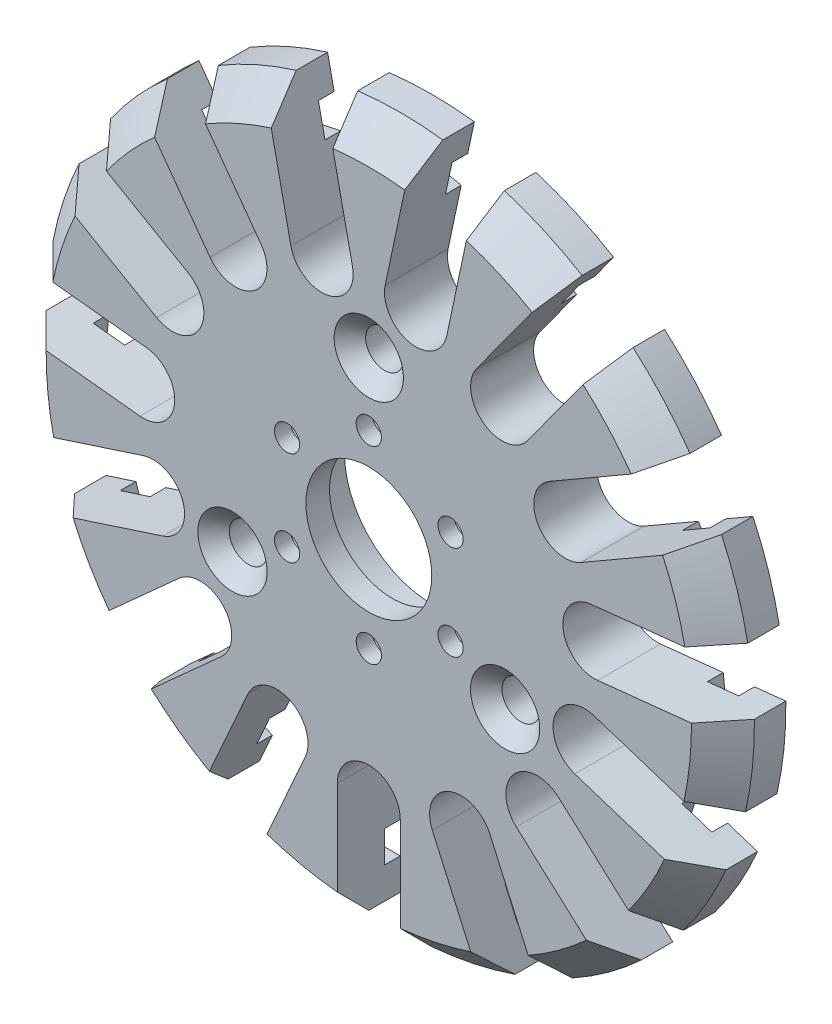
from build123d import *

# Parameters (mm, degrees)
ESBO_O1_R                                            = 22.5
RESSALTO_EXTRUS_O1_DEPTH                             = 4
CHANFRO1_SIZE                                        = 2
ESBO_O4_R                                            = 5.55
CORTE_EXTRUS_O2_DEPTH                                = 2.5
ESBO_O5_R                                            = 4
CORTE_EXTRUS_O3_DEPTH                                = 2
CORTE_EXTRUS_O4_DEPTH                                = 4
PADR_OCIRCULAR1_COUNT                                = 15
ESCAREADO_PARA_PARAFUSO_COM_CABE_A_ESCAR_D           = 2.4
ESCAREADO_PARA_PARAFUSO_COM_CABE_A_ESCAR_CSINK_D     = 4.4
ESCAREADO_PARA_PARAFUSO_COM_CABE_A_ESCAR_CSINK_ANGLE = 90
PADR_OCIRCULAR2_COUNT                                = 6
ESBO_O12_W                                           = 7
ESBO_O12_H                                           = 2
CORTE_EXTRUS_O5_DEPTH                                = 1
PADR_OCIRCULAR3_COUNT                                = 15
PADR_OCIRCULAR4_COUNT                                = 3


with BuildPart() as part:
    # Esboço1 → Ressalto-extrusão1 (new body)
    with BuildSketch(Plane.XY):
        Circle(ESBO_O1_R)
    extrude(amount=RESSALTO_EXTRUS_O1_DEPTH)

    # Chanfro1
    chanfro1_edges = [part.edges().sort_by_distance(p)[0] for p in [
        (-22.5, 0, 4),
    ]]
    chamfer(chanfro1_edges, length=CHANFRO1_SIZE)

    # Esboço4 → Corte-extrusão2 (cut)
    with BuildSketch(Plane(origin=(0, 0, 0), x_dir=(-1, 0, 0), z_dir=(0, 0, -1))):
        Circle(ESBO_O4_R)
    extrude(amount=-CORTE_EXTRUS_O2_DEPTH, mode=Mode.SUBTRACT)

    # Esboço5 → Corte-extrusão3 (cut)
    with BuildSketch(Plane(origin=(0, 0, 2.5), x_dir=(-1, 0, 0), z_dir=(0, 0, -1))):
        Circle(ESBO_O5_R)
    extrude(amount=-CORTE_EXTRUS_O3_DEPTH, mode=Mode.SUBTRACT)

    # Esboço6 → Corte-extrusão4 (cut)
    with BuildSketch(Plane(origin=(0, 0, 0), x_dir=(-1, 0, 0), z_dir=(0, 0, -1))):
        with BuildLine():
            Line((2, -22.410934831), (2, -14.410934831))
            ThreePointArc((2, -14.410934831), (0, -12.410934831), (-2, -14.410934831))
            Line((-2, -14.410934831), (-2, -22.410934831))
            ThreePointArc((-2, -22.410934831), (0, -22.5), (2, -22.410934831))
        make_face()
    corte_extrus_o4 = extrude(amount=-CORTE_EXTRUS_O4_DEPTH, mode=Mode.SUBTRACT)

    # PadrãoCircular1: Corte-extrusão4 ×15 about axis
    padr_ocircular1_axis = Axis((0, 0, 0), (0, 0, 1))
    for i in range(1, PADR_OCIRCULAR1_COUNT):
        add(corte_extrus_o4.rotate(padr_ocircular1_axis, i * 360 / PADR_OCIRCULAR1_COUNT), mode=Mode.SUBTRACT)

    # Esboço10 → Broca de rosquear para tarraxa de M21 (revolve, cut)
    with BuildSketch(Plane(origin=(0, 6, 4), x_dir=(0, -1, 0), z_dir=(1, 0, 0))):
        Polygon((0, 0), (0, 1.5), (0.8, 1.019311505), (0.8, 0), align=None)
    broca_de_rosquear_para_tarraxa_de_m21 = revolve(axis=Axis((0, 6, 10.35), (0, 0, -1)), mode=Mode.SUBTRACT)

    # Escareado para parafuso com cabeça escareada chata de M21 (through all)
    with Locations(Plane(origin=(0, 10, 4), x_dir=(1, 0, 0), z_dir=(0, 0, 1))):
        with Locations((0, 0)):
            escareado_para_parafuso_com_cabe_a_escar = CounterSinkHole(ESCAREADO_PARA_PARAFUSO_COM_CABE_A_ESCAR_D / 2, ESCAREADO_PARA_PARAFUSO_COM_CABE_A_ESCAR_CSINK_D / 2, counter_sink_angle=ESCAREADO_PARA_PARAFUSO_COM_CABE_A_ESCAR_CSINK_ANGLE)

    # PadrãoCircular2: Broca de rosquear para tarraxa de M21 ×6 about axis
    padr_ocircular2_axis = Axis((0, 0, 0), (0, 0, 1))
    for i in range(1, PADR_OCIRCULAR2_COUNT):
        add(broca_de_rosquear_para_tarraxa_de_m21.rotate(padr_ocircular2_axis, i * 360 / PADR_OCIRCULAR2_COUNT), mode=Mode.SUBTRACT)

    # Esboço12 → Corte-extrusão5 (cut)
    with BuildSketch(Plane(origin=(0, 0, 0), x_dir=(-1, 0, 0), z_dir=(0, 0, -1))):
        with Locations((0, -19.410934831)):
            Rectangle(ESBO_O12_W, ESBO_O12_H)
    corte_extrus_o5 = extrude(amount=-CORTE_EXTRUS_O5_DEPTH, mode=Mode.SUBTRACT)

    # PadrãoCircular3: Corte-extrusão5 ×15 about axis
    padr_ocircular3_axis = Axis((0, 0, 0), (0, 0, 1))
    for i in range(1, PADR_OCIRCULAR3_COUNT):
        add(corte_extrus_o5.rotate(padr_ocircular3_axis, i * 360 / PADR_OCIRCULAR3_COUNT), mode=Mode.SUBTRACT)

    # PadrãoCircular4: Escareado para parafuso com cabeça escareada chata de M21 ×3 about axis
    padr_ocircular4_axis = Axis((0, 0, 0), (0, 0, 1))
    for i in range(1, PADR_OCIRCULAR4_COUNT):
        add(escareado_para_parafuso_com_cabe_a_escar.rotate(padr_ocircular4_axis, i * 360 / PADR_OCIRCULAR4_COUNT), mode=Mode.SUBTRACT)


solid = part.part
